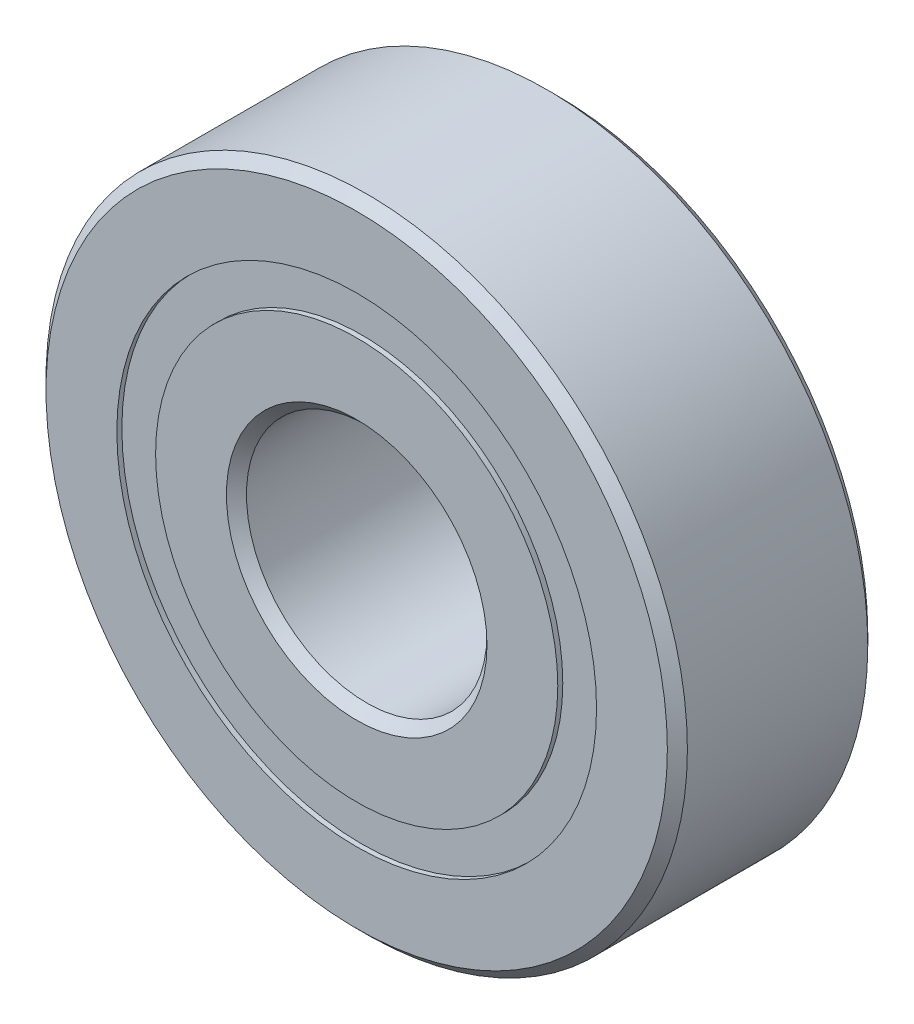
from build123d import *

# Parameters (mm, degrees)
CIRPATTERN1_COUNT = 12
SKETCH5_W         = 2.326485122
SKETCH5_H         = 1.934065934


with BuildPart() as part:
    # Sketch1 → Revolve1 (revolve)
    with BuildSketch(Plane(origin=(0, 0, 0), x_dir=(0, 0, -1), z_dir=(1, 0, 0))):
        with BuildLine():
            Line((4.5, 16), (-4.5, 16))
            Line((-4.5, 16), (-5, 15.5))
            Line((-5, 15.5), (-5, 11.967032967))
            Line((-5, 11.967032967), (-2.222222222, 11.967032967))
            ThreePointArc((-2.222222222, 11.967032967), (0, 13.423514878), (2.222222222, 11.967032967))
            Line((2.222222222, 11.967032967), (5, 11.967032967))
            Line((5, 11.967032967), (5, 15.5))
            Line((5, 15.5), (4.5, 16))
        make_face()
    revolve(axis=Axis((0, 0, 5), (0, 0, -1)))


with BuildPart() as body_2:
    # Sketch3 → Revolve3 (revolve)
    with BuildSketch(Plane(origin=(0, 0, 0), x_dir=(0, 0, -1), z_dir=(1, 0, 0))):
        with BuildLine():
            Line((-5, 10.032967033), (-2.222222222, 10.032967033))
            ThreePointArc((-2.222222222, 10.032967033), (0, 8.576485122), (2.222222222, 10.032967033))
            Line((2.222222222, 10.032967033), (5, 10.032967033))
            Line((5, 10.032967033), (5, 6.5))
            Line((5, 6.5), (4.5, 6))
            Line((4.5, 6), (-4.5, 6))
            Line((-4.5, 6), (-5, 6.5))
            Line((-5, 6.5), (-5, 10.032967033))
        make_face()
    revolve(axis=Axis((0, 0, 5), (0, 0, -1)))


with BuildPart() as body_3:
    # Sketch4 → Revolve4 (revolve)
    with BuildSketch(Plane(origin=(0, 0, 0), x_dir=(0, 0, -1), z_dir=(1, 0, 0))):
        with BuildLine():
            Line((-2.423514878, 11), (2.423514878, 11))
            ThreePointArc((2.423514878, 11), (0, 13.423514878), (-2.423514878, 11))
        make_face()
    revolve(axis=Axis((0, 11, 2.423514878), (0, 0, -1)))


with BuildPart() as cirpattern1_1:
    # CirPattern1: pattern copy
    add(body_3.part.rotate(Axis((0, 0, -5), (0, 0, 1)), 1 * 360 / CIRPATTERN1_COUNT))


with BuildPart() as cirpattern1_2:
    # CirPattern1: pattern copy
    add(body_3.part.rotate(Axis((0, 0, -5), (0, 0, 1)), 2 * 360 / CIRPATTERN1_COUNT))


with BuildPart() as cirpattern1_3:
    # CirPattern1: pattern copy
    add(body_3.part.rotate(Axis((0, 0, -5), (0, 0, 1)), 3 * 360 / CIRPATTERN1_COUNT))


with BuildPart() as cirpattern1_4:
    # CirPattern1: pattern copy
    add(body_3.part.rotate(Axis((0, 0, -5), (0, 0, 1)), 4 * 360 / CIRPATTERN1_COUNT))


with BuildPart() as cirpattern1_5:
    # CirPattern1: pattern copy
    add(body_3.part.rotate(Axis((0, 0, -5), (0, 0, 1)), 5 * 360 / CIRPATTERN1_COUNT))


with BuildPart() as cirpattern1_6:
    # CirPattern1: pattern copy
    add(body_3.part.rotate(Axis((0, 0, -5), (0, 0, 1)), 6 * 360 / CIRPATTERN1_COUNT))


with BuildPart() as cirpattern1_7:
    # CirPattern1: pattern copy
    add(body_3.part.rotate(Axis((0, 0, -5), (0, 0, 1)), 7 * 360 / CIRPATTERN1_COUNT))


with BuildPart() as cirpattern1_8:
    # CirPattern1: pattern copy
    add(body_3.part.rotate(Axis((0, 0, -5), (0, 0, 1)), 8 * 360 / CIRPATTERN1_COUNT))


with BuildPart() as cirpattern1_9:
    # CirPattern1: pattern copy
    add(body_3.part.rotate(Axis((0, 0, -5), (0, 0, 1)), 9 * 360 / CIRPATTERN1_COUNT))


with BuildPart() as cirpattern1_10:
    # CirPattern1: pattern copy
    add(body_3.part.rotate(Axis((0, 0, -5), (0, 0, 1)), 10 * 360 / CIRPATTERN1_COUNT))


with BuildPart() as cirpattern1_11:
    # CirPattern1: pattern copy
    add(body_3.part.rotate(Axis((0, 0, -5), (0, 0, 1)), 11 * 360 / CIRPATTERN1_COUNT))


with BuildPart() as body_15:
    # Sketch5 → Revolve5 (revolve)
    with BuildSketch(Plane(origin=(0, 0, 0), x_dir=(0, 0, -1), z_dir=(1, 0, 0))):
        with Locations((-3.586757439, 11)):
            Rectangle(SKETCH5_W, SKETCH5_H)
        with Locations((3.586757439, 11)):
            Rectangle(SKETCH5_W, SKETCH5_H)
    revolve(axis=Axis((0, 0, 5), (0, 0, -1)))


solid = Compound([part.part, body_2.part, body_3.part, cirpattern1_1.part, cirpattern1_2.part, cirpattern1_3.part, cirpattern1_4.part, cirpattern1_5.part, cirpattern1_6.part, cirpattern1_7.part, cirpattern1_8.part, cirpattern1_9.part, cirpattern1_10.part, cirpattern1_11.part, body_15.part])
